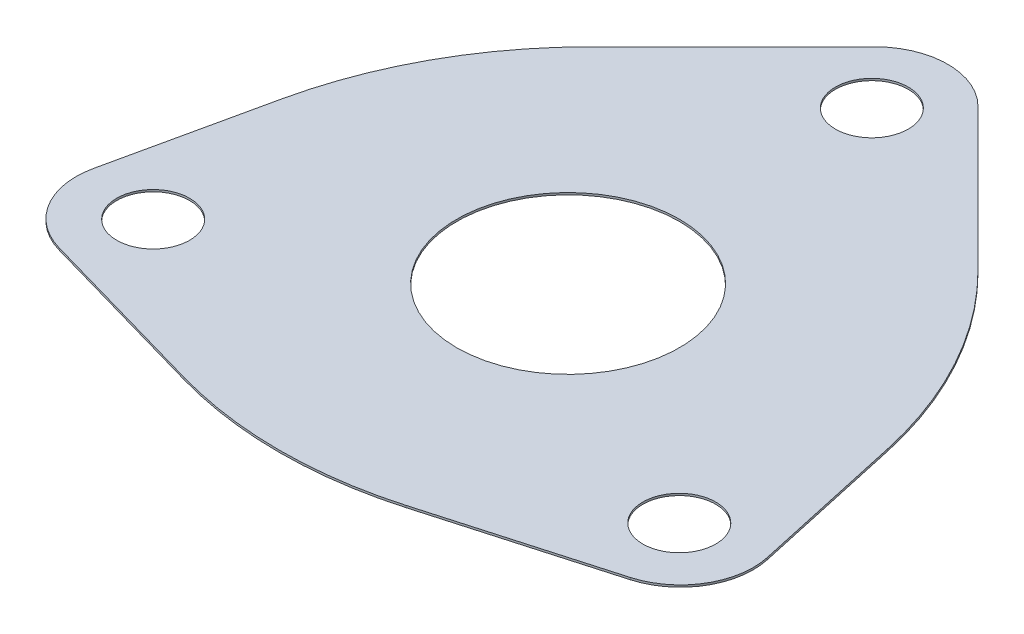
from build123d import *

# Parameters (mm, degrees)
SKETCH1_R           = 9
SKETCH1_R_2         = 27.5
BOSS_EXTRUDE1_DEPTH = 0.5


with BuildPart() as part:
    # Sketch1 → Boss-Extrude1 (new body)
    with BuildSketch(Plane(origin=(0, 0, 0), x_dir=(1, 0, 0), z_dir=(0, 1, 0))):
        with BuildLine():
            Line((83.18433382, -34.014993866), (74.814746992, 4.094782055))
            ThreePointArc((74.814746992, 4.094782055), (64.862734133, 30.656248168), (47.853152302, 53.354886188))
            Line((47.853152302, 53.354886188), (12.727922061, 88.480116429))
            ThreePointArc((12.727922061, 88.480116429), (0, 93.752194367), (-12.727922061, 88.480116429))
            Line((-12.727922061, 88.480116429), (-47.853152302, 53.354886188))
            ThreePointArc((-47.853152302, 53.354886188), (-64.862734133, 30.656248168), (-74.814746992, 4.094782055))
            Line((-74.814746992, 4.094782055), (-83.18433382, -34.014993866))
            ThreePointArc((-83.18433382, -34.014993866), (-81.055302304, -47.108452711), (-70.533966025, -55.187618673))
            Line((-70.533966025, -55.187618673), (-27.392451725, -67.475119384))
            ThreePointArc((-27.392451725, -67.475119384), (0, -71.3), (27.392451725, -67.475119384))
            Line((27.392451725, -67.475119384), (70.533966025, -55.187618673))
            ThreePointArc((70.533966025, -55.187618673), (81.055302304, -47.108452711), (83.18433382, -34.014993866))
        make_face()
        with Locations(Location((64.951905284, -37.5, 0), (0, 0, 270))):
            Circle(SKETCH1_R, mode=Mode.SUBTRACT)
        with Locations(Location((-64.951905284, -37.5, 0), (0, 0, 90))):
            Circle(SKETCH1_R, mode=Mode.SUBTRACT)
        with Locations(Location((0, 75, 0), (0, 0, 270))):
            Circle(SKETCH1_R, mode=Mode.SUBTRACT)
        with Locations(Location((0, 0, 0), (0, 0, 270))):
            Circle(SKETCH1_R_2, mode=Mode.SUBTRACT)
    extrude(amount=BOSS_EXTRUDE1_DEPTH)


solid = part.part
